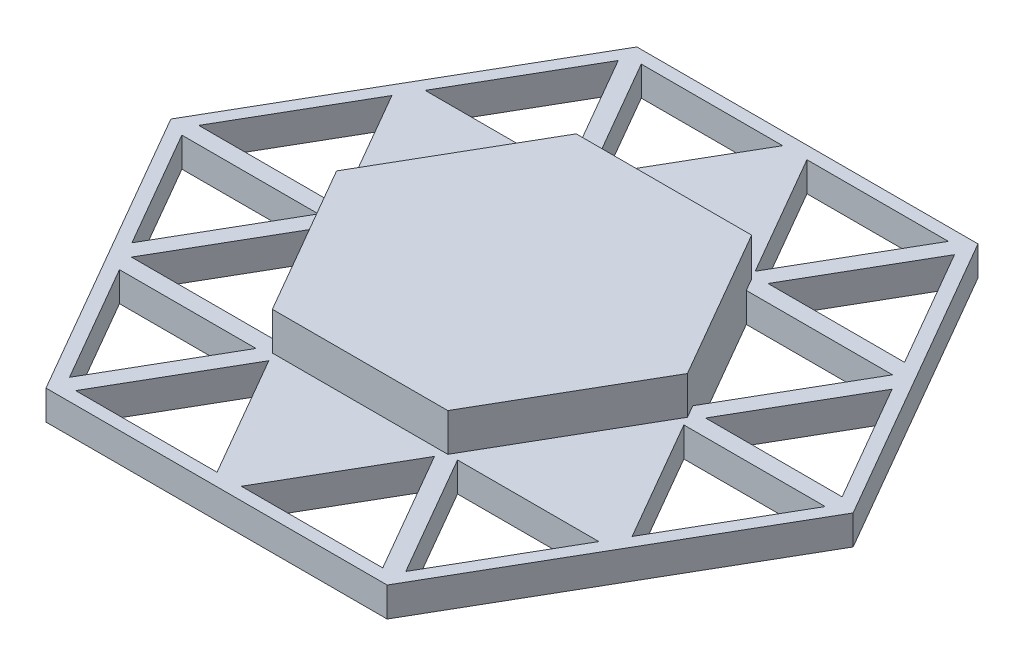
from build123d import *

# Parameters (mm, degrees)
EXTRUDE_1_DEPTH = 7
EXTRUDE_2_DEPTH = 9


with BuildPart() as part:
    # 草图1 → 凸台-拉伸1 (new body)
    with BuildSketch(Plane(origin=(0, 0, 0), x_dir=(1, 0, 0), z_dir=(0, 1, 0))):
        Polygon((-112.559101124, 19.665498127), (-92.311400749, -15.404547658), (-72.063700375, -50.474593443), (-31.568299625, -50.474593443), (8.927101124, -50.474593443), (29.174801498, -15.404547658), (49.422501873, 19.665498127), (29.174801498, 54.735543912), (8.927101124, 89.805589698), (-31.568299625, 89.805589698), (-72.063700375, 89.805589698), (-92.311400749, 54.735543912), align=None)
        Polygon((-68.02224849, 86.805589698), (-34.455050971, 86.805589698), (-51.23864973, 57.735543912), align=None, mode=Mode.SUBTRACT)
        Polygon((8.349750855, 84.805589697), (24.555999345, 56.735543912), (-7.856497635, 56.735543912), align=None, mode=Mode.SUBTRACT)
        Polygon((-9.011198174, 52.735543912), (8.349750855, 22.665498127), (25.710699883, 52.735543912), align=None, mode=Mode.SUBTRACT)
        Polygon((28.597451229, 49.735543912), (44.803699719, 21.665498127), (12.39120274, 21.665498127), align=None, mode=Mode.SUBTRACT)
        Polygon((11.2365022, 17.665498127), (28.02010096, -11.404547658), (44.803699719, 17.665498127), align=None, mode=Mode.SUBTRACT)
        Polygon((-8.433847905, -16.404547658), (25.133349614, -16.404547658), (8.349750854, -45.474593443), align=None, mode=Mode.SUBTRACT)
        Polygon((-11.89794952, -18.404547658), (4.885649239, -47.474593443), (-28.68154828, -47.474593443), align=None, mode=Mode.SUBTRACT)
        Polygon((-28.681548279, 86.805589698), (4.885649241, 86.805589698), (-11.897949519, 57.735543911), align=None, mode=Mode.SUBTRACT)
        Polygon((-88.269948864, 55.735543912), (-71.486350105, 84.805589697), (-54.702751346, 55.735543912), align=None, mode=Mode.SUBTRACT)
        Polygon((-107.940298969, 21.665498127), (-91.15670021, 50.735543912), (-74.373101451, 21.665498127), align=None, mode=Mode.SUBTRACT)
        Polygon((-75.52780199, 17.665498127), (-107.94029897, 17.665498127), (-91.73405048, -10.404547658), align=None, mode=Mode.SUBTRACT)
        Polygon((-88.847299134, -13.404547658), (-54.125401077, -13.404547658), (-71.486350105, 16.665498127), align=None, mode=Mode.SUBTRACT)
        Polygon((-68.02224849, -47.474593443), (-34.455050971, -47.474593443), (-51.238649731, -18.404547658), align=None, mode=Mode.SUBTRACT)
        Polygon((-87.692598596, -17.404547658), (-71.486350105, -45.474593443), (-55.280101615, -17.404547658), align=None, mode=Mode.SUBTRACT)
    extrude(amount=EXTRUDE_1_DEPTH)

    # 草图2 → 凸台-拉伸2 (add)
    with BuildSketch(Plane(origin=(0, 7, 0), x_dir=(1, 0, 0), z_dir=(0, 1, 0))):
        Polygon((-71.486350105, 16.665498127), (-73.218400913, 19.665498127), (-52.393350269, 55.735543912), (-10.743248982, 55.735543912), (10.081801662, 19.665498127), (-10.743248982, -16.404547658), (-52.393350269, -16.404547658), align=None)
    extrude(amount=EXTRUDE_2_DEPTH)


solid = part.part
